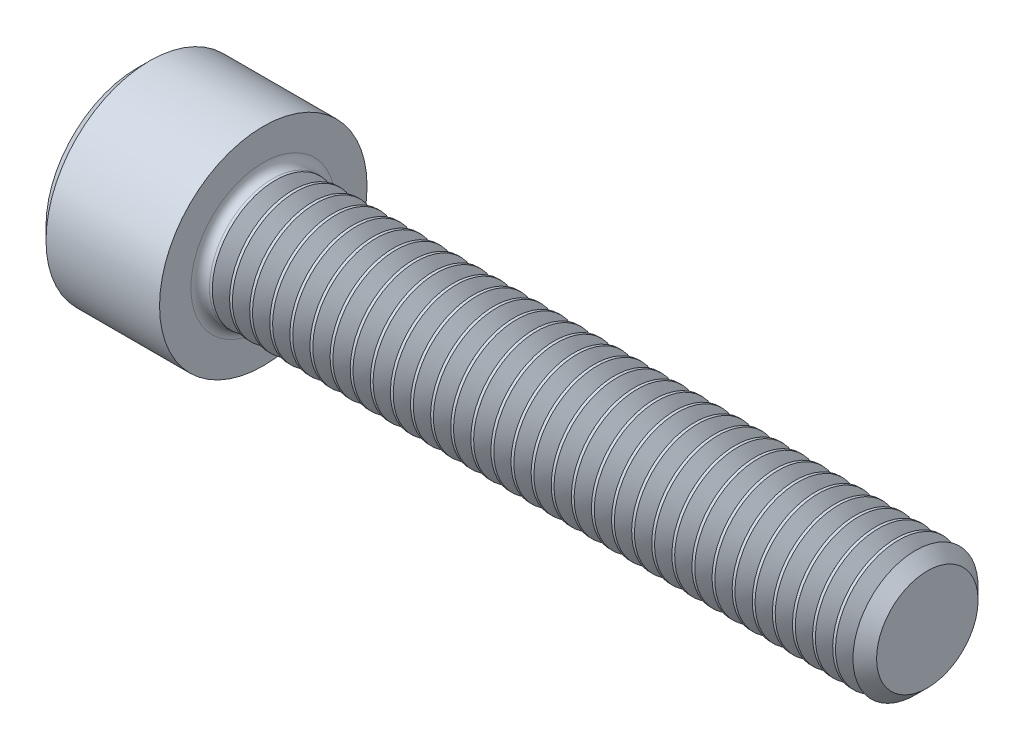
from build123d import *

# Parameters (mm, degrees)
FILLET1_R       = 0.3556
HEX_2_DEPTH     = 2.286
THDSCHPAT_COUNT = 32
THDSCHPAT_PITCH = 0.768985


with BuildPart() as part:
    # BodySke → Base-Revolve (revolve)
    with BuildSketch(Plane.XY, mode=Mode.PRIVATE) as base_revolve_sk:
        Polygon((0, 0), (0, 3.48615), (0.4826, 3.96875), (4.826, 3.96875), (4.826, 2.413), (29.75356, 2.413), (30.226, 1.94056), (30.226, 0), align=None)
    revolve(base_revolve_sk.sketch.rotate(Axis((-31.75, 0, 0), (1, 0, 0)), 90), axis=Axis((-31.75, 0, 0), (1, 0, 0)))

    # Fillet1
    fillet1_edges = [part.edges().sort_by_distance(p)[0] for p in [
        (4.826, 0, -2.413),
    ]]
    fillet(fillet1_edges, radius=FILLET1_R)

    # Sketch2 → Hex-PreBroach (revolve, cut)
    with BuildSketch(Plane.XY, mode=Mode.PRIVATE) as hex_prebroach_sk:
        Polygon((0, 1.98501), (2.286, 1.98501), (3.432046058, 0), (0, 0), align=None)
    revolve(hex_prebroach_sk.sketch.rotate(Axis((0, 0, 0), (1, 0, 0)), 90), axis=Axis((0, 0, 0), (1, 0, 0)), mode=Mode.SUBTRACT)

    # Sketch3 → Hex 2 (cut)
    with BuildSketch(Plane(origin=(0, 0, 0), x_dir=(0, 0.500000000000001, 0.866025403784438), z_dir=(-1, 0, 0))):
        Polygon((1.146046058, 1.98501), (-1.146046058, 1.98501), (-2.292092116, 0), (-1.146046058, -1.98501), (1.146046058, -1.98501), (2.292092116, 0), align=None)
    extrude(amount=-HEX_2_DEPTH, mode=Mode.SUBTRACT)

    # ThdSchSke → ThreadSchematic (revolve, cut)
    with BuildSketch(Plane.XY):
        Polygon((5.61848, -1.94056), (5.287673951, -2.413), (5.287673951, -3.01625), (5.949286049, -3.01625), (5.949286049, -2.413), align=None)
    threadschematic = revolve(axis=Axis((-3.175, 0, 0), (1, 0, 0)), mode=Mode.SUBTRACT)

    # ThdSchPat: ThreadSchematic ×32
    with Locations(*[(i * THDSCHPAT_PITCH, 0, 0) for i in range(1, THDSCHPAT_COUNT)]):
        add(threadschematic, mode=Mode.SUBTRACT)


solid = part.part
